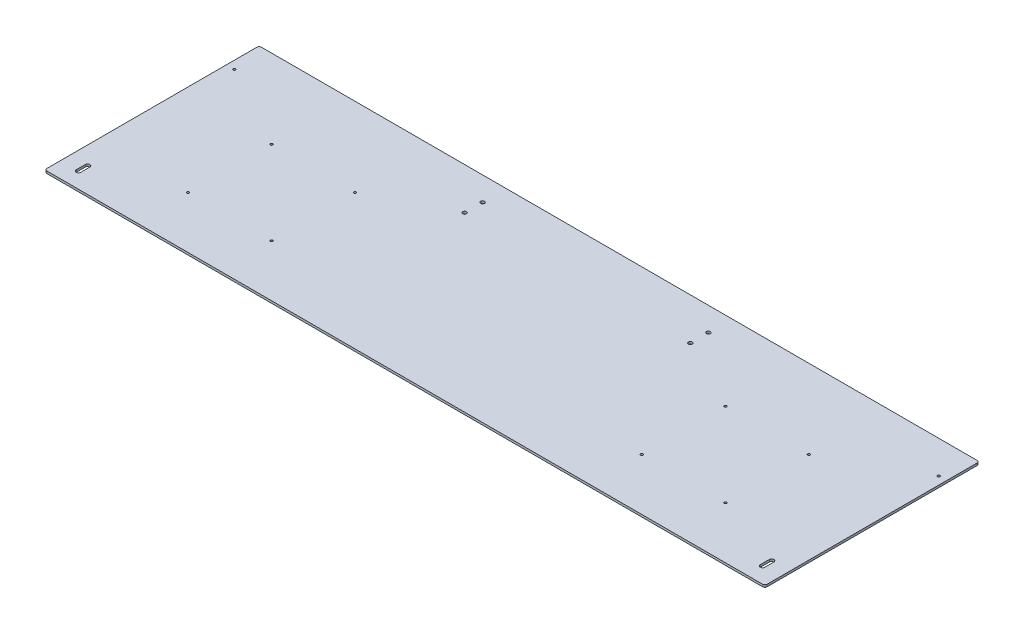
from build123d import *

# Parameters (mm, degrees)
SKETCH1_R           = 5.3578125
SKETCH1_R_2         = 3.3782
SKETCH1_R_3         = 3.3734375
BOSS_EXTRUDE1_DEPTH = 6.35


with BuildPart() as part:
    # Sketch1 → Boss-Extrude1 (new body)
    with BuildSketch(Plane(origin=(0, 0, 0), x_dir=(1, 0, 0), z_dir=(0, 1, 0))):
        with BuildLine():
            Line((6.35, 0), (2019.3, 0))
            ThreePointArc((2019.3, 0), (2023.790128061, 1.859871939), (2025.65, 6.35))
            Line((2025.65, 6.35), (2025.65, 596.9))
            ThreePointArc((2025.65, 596.9), (2023.790128061, 601.390128061), (2019.3, 603.25))
            Line((2019.3, 603.25), (6.35, 603.25))
            ThreePointArc((6.35, 603.25), (1.859871939, 601.390128061), (0, 596.9))
            Line((0, 596.9), (0, 6.35))
            ThreePointArc((0, 6.35), (1.859871939, 1.859871939), (6.35, 0))
        make_face()
        with Locations(Location((695.325, 485.775, 0), (0, 0, 270))):
            Circle(SKETCH1_R, mode=Mode.SUBTRACT)
        with Locations(Location((1330.325, 485.775, 0), (0, 0, 270))):
            Circle(SKETCH1_R, mode=Mode.SUBTRACT)
        with Locations(Location((257.175, 381, 0), (0, 0, 270))):
            Circle(SKETCH1_R_2, mode=Mode.SUBTRACT)
        with Locations(Location((492.125, 381, 0), (0, 0, 270))):
            Circle(SKETCH1_R_2, mode=Mode.SUBTRACT)
        with Locations(Location((492.125, 146.05, 0), (0, 0, 270))):
            Circle(SKETCH1_R_2, mode=Mode.SUBTRACT)
        with Locations(Location((257.175, 146.05, 0), (0, 0, 270))):
            Circle(SKETCH1_R_2, mode=Mode.SUBTRACT)
        with Locations(Location((695.325, 536.575, 0), (0, 0, 270))):
            Circle(SKETCH1_R, mode=Mode.SUBTRACT)
        with Locations(Location((1768.475, 146.05, 0), (0, 0, 90))):
            Circle(SKETCH1_R_2, mode=Mode.SUBTRACT)
        with Locations(Location((1533.525, 146.05, 0), (0, 0, 90))):
            Circle(SKETCH1_R_2, mode=Mode.SUBTRACT)
        with Locations(Location((1533.525, 381, 0), (0, 0, 90))):
            Circle(SKETCH1_R_2, mode=Mode.SUBTRACT)
        with Locations(Location((1768.475, 381, 0), (0, 0, 90))):
            Circle(SKETCH1_R_2, mode=Mode.SUBTRACT)
        with Locations(Location((22.225, 511.175, 0), (0, 0, 270))):
            Circle(SKETCH1_R_3, mode=Mode.SUBTRACT)
        with Locations(Location((2003.425, 511.175, 0), (0, 0, 90))):
            Circle(SKETCH1_R_3, mode=Mode.SUBTRACT)
        with Locations(Location((1330.325, 536.575, 0), (0, 0, 270))):
            Circle(SKETCH1_R, mode=Mode.SUBTRACT)
        with BuildLine():
            Line((57.15, 69.85), (57.15, 44.45))
            ThreePointArc((57.15, 44.45), (50.8, 38.1), (44.45, 44.45))
            Line((44.45, 44.45), (44.45, 69.85))
            ThreePointArc((44.45, 69.85), (50.8, 76.2), (57.15, 69.85))
        make_face(mode=Mode.SUBTRACT)
        with BuildLine():
            Line((1968.5, 69.85), (1968.5, 44.45))
            ThreePointArc((1968.5, 44.45), (1974.85, 38.1), (1981.2, 44.45))
            Line((1981.2, 44.45), (1981.2, 69.85))
            ThreePointArc((1981.2, 69.85), (1974.85, 76.2), (1968.5, 69.85))
        make_face(mode=Mode.SUBTRACT)
    extrude(amount=BOSS_EXTRUDE1_DEPTH)


solid = part.part
